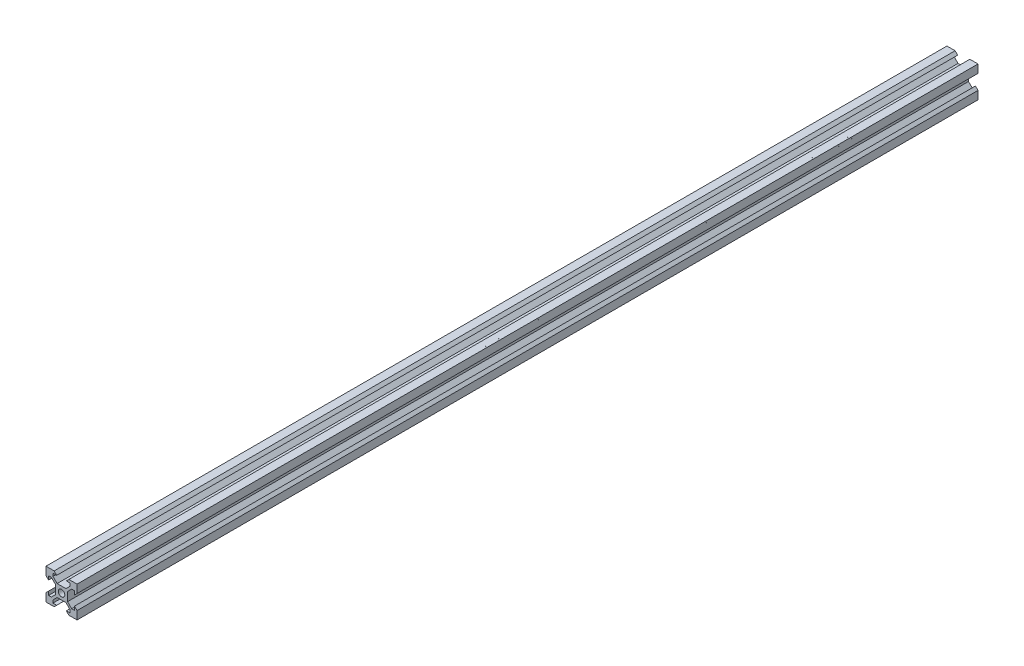
from build123d import *

# Parameters (mm, degrees)
SKETCH1_R           = 2.1
BOSS_EXTRUDE1_DEPTH = 290


with BuildPart() as part:
    # Sketch1 → Boss-Extrude1 (new, symmetric)
    with BuildSketch(Plane.XY):
        Polygon((2.834320347, 3.893970342), (5.5, 6.558849663), (5.5, 8.349069506), (3.1, 8.349069506), (4.75, 9.998574117), (10, 9.998574117), (10, 4.746997406), (8.35, 3.097492795), (8.350720674, 5.497492687), (6.560500912, 5.498030255), (3.894821259, 2.833150935), (3.894821259, -2.833150935), (6.560500912, -5.498030255), (8.350720674, -5.497492687), (8.35, -3.097492795), (10, -4.746997406), (10, -9.998574117), (4.75, -9.998574117), (3.1, -8.349069506), (5.5, -8.349069506), (5.5, -6.558849663), (2.834320347, -3.893970342), (-2.834320347, -3.893970342), (-5.5, -6.558849663), (-5.5, -8.349069506), (-3.1, -8.349069506), (-4.75, -9.998574117), (-10, -9.998574117), (-10, -4.746997406), (-8.35, -3.097492795), (-8.350720674, -5.497492687), (-6.560500912, -5.498030255), (-3.894821259, -2.833150935), (-3.894821259, 2.833150935), (-6.560500912, 5.498030255), (-8.350720674, 5.497492687), (-8.35, 3.097492795), (-10, 4.746997406), (-10, 9.998574117), (-4.75, 9.998574117), (-3.1, 8.349069506), (-5.5, 8.349069506), (-5.5, 6.558849663), (-2.834320347, 3.893970342), align=None)
        Circle(SKETCH1_R, mode=Mode.SUBTRACT)
    extrude(amount=BOSS_EXTRUDE1_DEPTH, both=True)


solid = part.part
